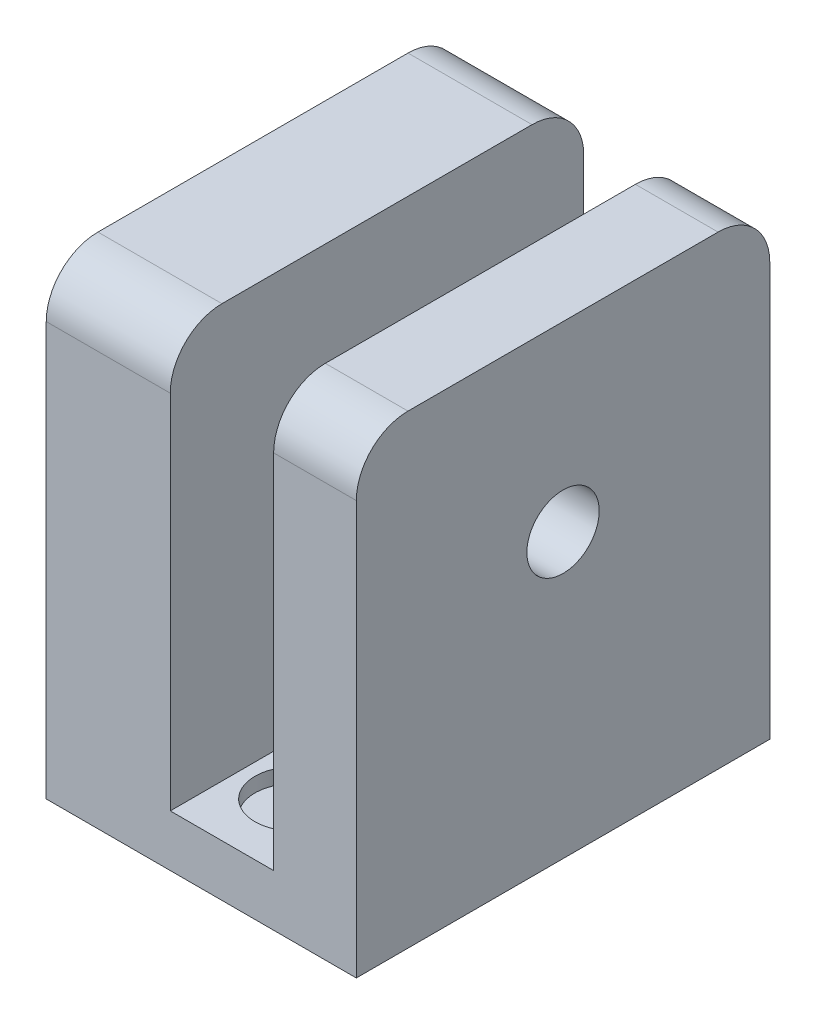
from build123d import *

# Parameters (mm, degrees)
SKETCH1_W                                    = 30
SKETCH1_H                                    = 40
BOSS_EXTRUDE1_DEPTH                          = 45
SKETCH2_W                                    = 10
SKETCH2_H                                    = 40
CUT_EXTRUDE1_DEPTH                           = 63.04836823
SKETCH3_R                                    = 3.5
CUT_EXTRUDE2_DEPTH                           = 58.662812973
CUT_EXTRUDE3_DEPTH                           = 58.662812973
CBORE_FOR_M2_HEX_HEAD_CAP_SCREW1_D           = 2.4
CBORE_FOR_M2_HEX_HEAD_CAP_SCREW1_CBORE_D     = 7.619
CBORE_FOR_M2_HEX_HEAD_CAP_SCREW1_CBORE_DEPTH = 1.4


with BuildPart() as part:
    # Sketch1 → Boss-Extrude1 (new body)
    with BuildSketch(Plane(origin=(0, 0, 0), x_dir=(1, 0, 0), z_dir=(0, 1, 0))):
        Rectangle(SKETCH1_W, SKETCH1_H)
    extrude(amount=BOSS_EXTRUDE1_DEPTH)

    # Sketch2 → Cut-Extrude1 (cut, through all)
    with BuildSketch(Plane.XY.offset(20)):
        with Locations((2, 25)):
            Rectangle(SKETCH2_W, SKETCH2_H)
    extrude(amount=-CUT_EXTRUDE1_DEPTH, mode=Mode.SUBTRACT)

    # Sketch3 → Cut-Extrude2 (cut, through all)
    with BuildSketch(Plane.ZY.offset(15)):
        with Locations((0, 27.391853945)):
            Circle(SKETCH3_R)
    extrude(amount=-CUT_EXTRUDE2_DEPTH, mode=Mode.SUBTRACT)

    # Sketch4 → Cut-Extrude3 (cut, through all)
    with BuildSketch(Plane.ZY.offset(15)):
        with BuildLine():
            Line((-20, 45), (-15, 45))
            ThreePointArc((-15, 45), (-18.535533906, 43.535533906), (-20, 40))
            Line((-20, 40), (-20, 45))
        make_face()
        with BuildLine():
            Line((15, 45), (20, 45))
            Line((20, 45), (20, 40))
            ThreePointArc((20, 40), (18.535533906, 43.535533906), (15, 45))
        make_face()
    extrude(amount=-CUT_EXTRUDE3_DEPTH, mode=Mode.SUBTRACT)

    # CBORE for M2 Hex Head Cap Screw1 (through all)
    with Locations(Plane(origin=(0, 5, 0), x_dir=(1, 0, 0), z_dir=(0, 1, 0))):
        with Locations((2, -13), (2, 13)):
            CounterBoreHole(CBORE_FOR_M2_HEX_HEAD_CAP_SCREW1_D / 2, CBORE_FOR_M2_HEX_HEAD_CAP_SCREW1_CBORE_D / 2, CBORE_FOR_M2_HEX_HEAD_CAP_SCREW1_CBORE_DEPTH)


solid = part.part
